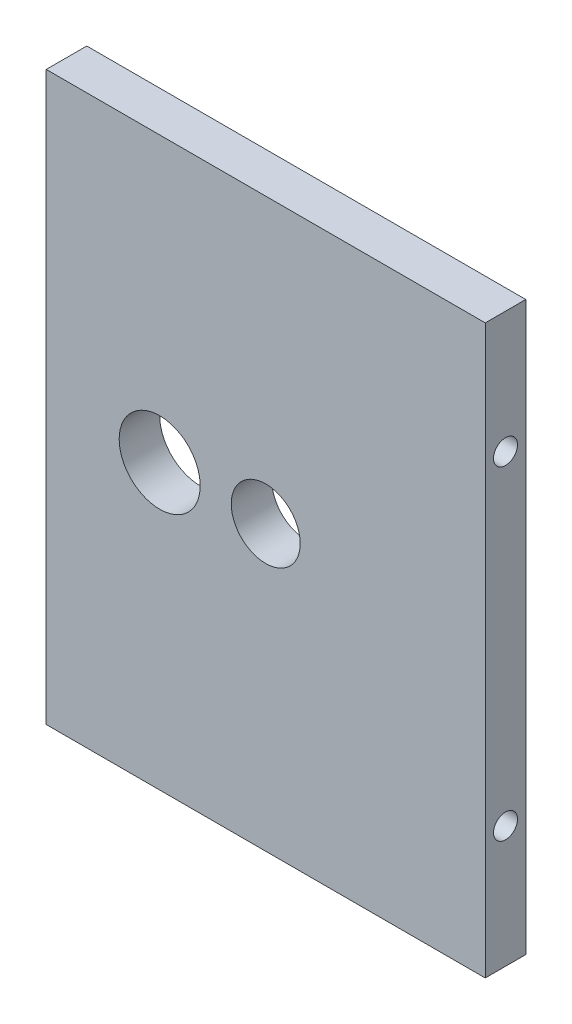
from build123d import *

# Parameters (mm, degrees)
SKETCH1_W                 = 32.5
SKETCH1_H                 = 42
BOSS_EXTRUDE2_DEPTH       = 3
F_2_56_TAPPED_HOLE1_D     = 1.778
F_2_56_TAPPED_HOLE1_DEPTH = 5.19583491
F_2_56_TAPPED_HOLE1_TIP   = 0.53416509
F_2_56_TAPPED_HOLE2_D     = 1.778
F_2_56_TAPPED_HOLE2_DEPTH = 5.19583491
F_2_56_TAPPED_HOLE2_TIP   = 0.53416509
CUT_EXTRUDE1_DEPTH        = 3
F_1_4_20_TAPPED_HOLE1_D   = 5.1054


with BuildPart() as part:
    # Sketch1 → Boss-Extrude2 (new body)
    with BuildSketch(Plane.XY):
        with Locations((16.25, 21)):
            Rectangle(SKETCH1_W, SKETCH1_H)
    extrude(amount=BOSS_EXTRUDE2_DEPTH)

    # #2-56 Tapped Hole1
    with Locations(Plane.ZY):
        with Locations((1.5, 33), (1.5, 9)):
            Hole(F_2_56_TAPPED_HOLE1_D / 2, depth=F_2_56_TAPPED_HOLE1_DEPTH)
            with Locations((0, 0, -(F_2_56_TAPPED_HOLE1_DEPTH + F_2_56_TAPPED_HOLE1_TIP / 2))):  # 118° drill point
                Cone(0, F_2_56_TAPPED_HOLE1_D / 2, F_2_56_TAPPED_HOLE1_TIP, mode=Mode.SUBTRACT)

    # #2-56 Tapped Hole2
    with Locations(Plane(origin=(32.5, 0, 0), x_dir=(0, 0, -1), z_dir=(1, 0, 0))):
        with Locations((-1.5, 33), (-1.5, 9)):
            Hole(F_2_56_TAPPED_HOLE2_D / 2, depth=F_2_56_TAPPED_HOLE2_DEPTH)
            with Locations((0, 0, -(F_2_56_TAPPED_HOLE2_DEPTH + F_2_56_TAPPED_HOLE2_TIP / 2))):  # 118° drill point
                Cone(0, F_2_56_TAPPED_HOLE2_D / 2, F_2_56_TAPPED_HOLE2_TIP, mode=Mode.SUBTRACT)

    # Sketch9 → Cut-Extrude1 (cut)
    with BuildSketch(Plane(origin=(0, 0, 0), x_dir=(-1, 0, 0), z_dir=(0, 0, -1))):
        with BuildLine():
            ThreePointArc((-11.4, 21), (-8.4, 18), (-5.4, 21))
            Line((-5.4, 21), (-8.4, 21))
            Line((-8.4, 21), (-11.4, 21))
        make_face()
        with BuildLine():
            Line((-8.4, 21), (-5.4, 21))
            ThreePointArc((-5.4, 21), (-8.4, 24), (-11.4, 21))
            Line((-11.4, 21), (-8.4, 21))
        make_face()
    extrude(amount=-CUT_EXTRUDE1_DEPTH, mode=Mode.SUBTRACT)

    # 1/4-20 Tapped Hole1 (through all)
    with Locations(Plane(origin=(0, 0, 0), x_dir=(-1, 0, 0), z_dir=(0, 0, -1))):
        with Locations((-16.25, 21)):
            Hole(F_1_4_20_TAPPED_HOLE1_D / 2)


solid = part.part
